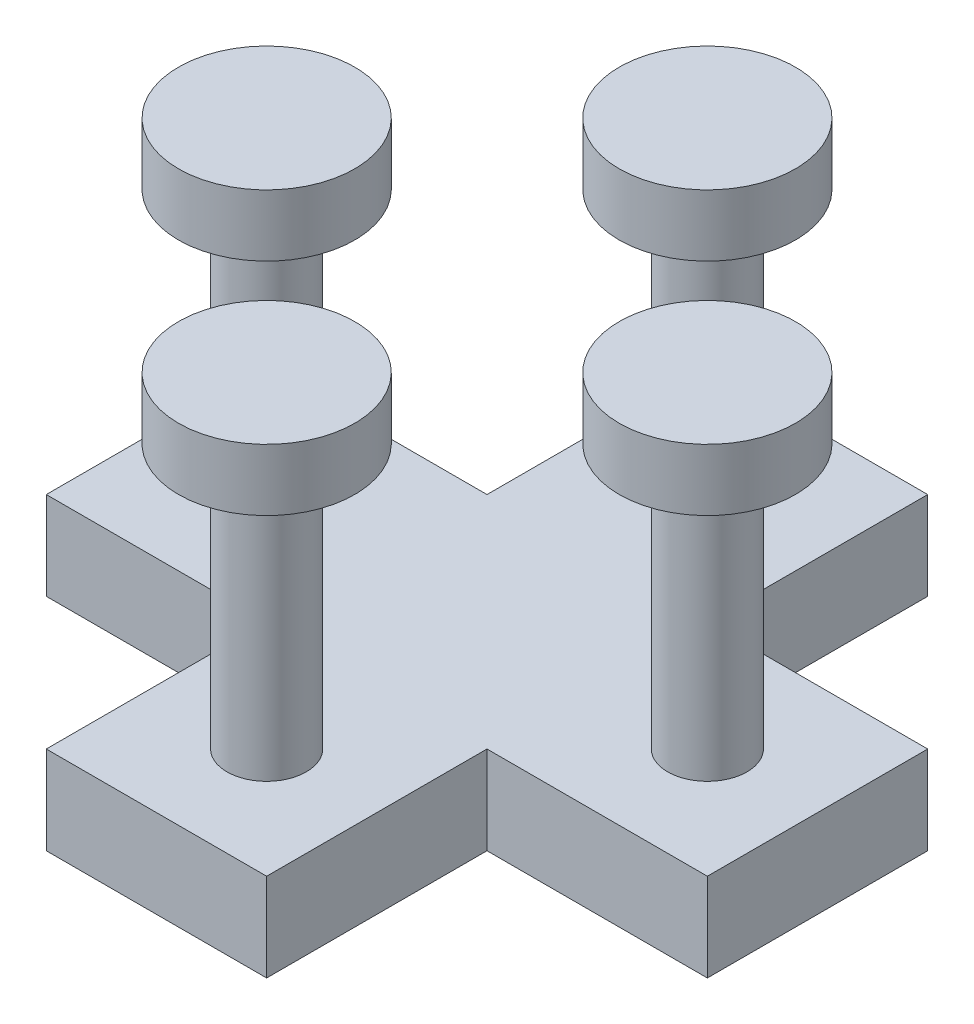
from build123d import *

# Parameters (mm, degrees)
BODY_DEPTH = 2.54
SKETCH2_R  = 1.143
FLAG_DEPTH = 7.62
SKETCH3_R  = 2.54
FEET_DEPTH = 1.778


with BuildPart() as part:
    # Sketch1 → body (new body)
    with BuildSketch(Plane(origin=(0, 0, 0), x_dir=(1, 0, 0), z_dir=(0, 1, 0))):
        Polygon((-8.348684361, -10.452067183), (-8.348684361, -4.102067183), (-1.998684361, -4.102067183), (-1.998684361, -10.452067183), (4.351315639, -10.452067183), (4.351315639, -16.802067183), (-1.998684361, -16.802067183), (-1.998684361, -23.152067183), (-8.348684361, -23.152067183), (-8.348684361, -16.802067183), (-14.698684361, -16.802067183), (-14.698684361, -10.452067183), align=None)
    extrude(amount=BODY_DEPTH)

    # Sketch2 → flag (add)
    with BuildSketch(Plane(origin=(0, 2.54, 0), x_dir=(1, 0, 0), z_dir=(0, 1, 0))):
        with Locations(Location((-5.173684361, -7.277067183, 0), (0, 0, 90))):
            Circle(SKETCH2_R)
        with Locations(Location((1.176315639, -13.627067183, 0), (0, 0, 90))):
            Circle(SKETCH2_R)
        with Locations(Location((-5.173684361, -19.977067183, 0), (0, 0, 90))):
            Circle(SKETCH2_R)
        with Locations(Location((-11.523684361, -13.627067183, 0), (0, 0, 90))):
            Circle(SKETCH2_R)
    extrude(amount=FLAG_DEPTH)

    # Sketch3 → feet (add)
    with BuildSketch(Plane(origin=(0, 10.16, 0), x_dir=(1, 0, 0), z_dir=(0, 1, 0))):
        with Locations(Location((-5.173684361, -7.277067183, 0), (0, 0, 270))):
            Circle(SKETCH3_R)
        with Locations(Location((-11.523684361, -13.627067183, 0), (0, 0, 270))):
            Circle(SKETCH3_R)
        with Locations(Location((-5.173684361, -19.977067183, 0), (0, 0, 270))):
            Circle(SKETCH3_R)
        with Locations(Location((1.176315639, -13.627067183, 0), (0, 0, 270))):
            Circle(SKETCH3_R)
    extrude(amount=FEET_DEPTH)


solid = part.part
